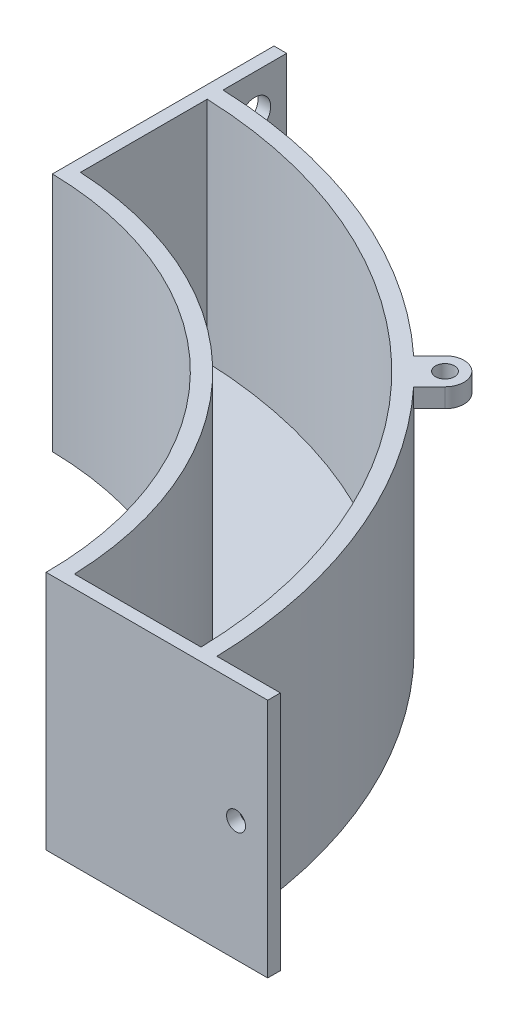
from build123d import *

# Parameters (mm, degrees)
EXTRUDE_1_DEPTH      = 36
EXTRUDE_START        = -2
EXTRUDE_2_DEPTH      = 2
SKETCH_3_R           = 2.5
SKETCH_3_R_2         = 1.5
CUT_EXTRUDE_1_DEPTH  = 126.677663072
EXTRUDE_3_DEPTH      = 2
EXTRUDE_3_DEPTH_BACK = 2
SKETCH_4_R           = 1.5
SKETCH_5_W           = 98.68516208
SKETCH_5_H           = 49.60110529
CUT_EXTRUDE_2_DEPTH  = 133.268193437
EXTRUDE_START_2      = -3
SKETCH_6_R           = 1.5
EXTRUDE_4_DEPTH      = 3


with BuildPart() as part:
    # 草图1 → 凸台-拉伸1 (new body)
    with BuildSketch(Plane(origin=(0, 0, 0), x_dir=(1, 0, 0), z_dir=(0, 1, 0))):
        with BuildLine():
            Line((3, -79.943730211), (3, -89.993749756))
            Line((3, -89.993749756), (1, -89.993749756))
            Line((1, -89.993749756), (1, -54.990908339))
            ThreePointArc((1, -54.990908339), (55, 0), (1, 54.990908339))
            Line((1, 54.990908339), (1, 79.993749756))
            Line((1, 79.993749756), (1, 89.993749756))
            Line((1, 89.993749756), (3, 89.993749756))
            Line((3, 89.993749756), (3, 79.943730211))
            ThreePointArc((3, 79.943730211), (80, 0), (3, -79.943730211))
        make_face()
        with BuildLine():
            Line((3, 77.441913716), (3, 57.421685799))
            ThreePointArc((3, 57.421685799), (57.5, 0), (3, -57.421685799))
            Line((3, -57.421685799), (3, -77.441913716))
            ThreePointArc((3, -77.441913716), (77.5, 0), (3, 77.441913716))
        make_face(mode=Mode.SUBTRACT)
    extrude(amount=EXTRUDE_1_DEPTH)

    # 草图2 → 凸台-拉伸2 (add)
    with BuildSketch(Plane(origin=(0, 0, 0), x_dir=(1, 0, 0), z_dir=(0, 1, 0)).offset(EXTRUDE_START)):
        with BuildLine():
            Line((1, 89.993749756), (1, 54.990908339))
            ThreePointArc((1, 54.990908339), (55, 0), (1, -54.990908339))
            Line((1, -54.990908339), (1, -89.993749756))
            Line((1, -89.993749756), (3, -89.993749756))
            Line((3, -89.993749756), (3, -79.943730211))
            ThreePointArc((3, -79.943730211), (80, 0), (3, 79.943730211))
            Line((3, 79.943730211), (3, 89.993749756))
            Line((3, 89.993749756), (1, 89.993749756))
        make_face()
    extrude(amount=EXTRUDE_2_DEPTH)

    # 草图3 → 切除-拉伸1 (cut, through all)
    with BuildSketch(Plane(origin=(0, 0, 0), x_dir=(0, 0, -1), z_dir=(1, 0, 0))):
        with Locations((-84.968739983, 30)):
            Circle(SKETCH_3_R)
        with Locations((-84.968739983, 17)):
            Circle(SKETCH_3_R_2)
        with Locations((84.968739983, 17)):
            Circle(SKETCH_3_R_2)
        with Locations((84.968739983, 30)):
            Circle(SKETCH_3_R)
        with Locations((-84.968739983, 4)):
            Circle(SKETCH_3_R)
        with Locations((84.968739983, 4)):
            Circle(SKETCH_3_R)
    extrude(amount=CUT_EXTRUDE_1_DEPTH, mode=Mode.SUBTRACT)

    # 草图4 → 凸台-拉伸3 (add, two sides: drawn at the far end of the back side and taken through both)
    with BuildSketch(Plane.XY.offset(-EXTRUDE_3_DEPTH_BACK)):
        Polygon((80, 36), (55, 36), (55, -2), (80, -2), (90, -2), (90, 36), align=None)
        with Locations((85, 17)):
            Circle(SKETCH_4_R, mode=Mode.SUBTRACT)
    extrude(amount=EXTRUDE_3_DEPTH + EXTRUDE_3_DEPTH_BACK)

    # 草图5 → 切除-拉伸2 (cut, through all)
    with BuildSketch(Plane.XY):
        with Locations((47.157910723, 21.418830203)):
            Rectangle(SKETCH_5_W, SKETCH_5_H)
    extrude(amount=CUT_EXTRUDE_2_DEPTH, mode=Mode.SUBTRACT)

    # 草图6 → 凸台-拉伸4 (add)
    with BuildSketch(Plane(origin=(0, 36, 0), x_dir=(1, 0, 0), z_dir=(0, 1, 0)).offset(EXTRUDE_START_2)):
        with BuildLine():
            Line((56.882307136, 61.124947823), (54.407433402, 58.650074089))
            ThreePointArc((54.407433402, 58.650074089), (56.568542495, 56.568542495), (58.650074089, 54.407433402))
            Line((58.650074089, 54.407433402), (61.124947823, 56.882307136))
            ThreePointArc((61.124947823, 56.882307136), (61.124947823, 61.124947823), (56.882307136, 61.124947823))
        make_face()
        with Locations((59.003627479, 59.003627479)):
            Circle(SKETCH_6_R, mode=Mode.SUBTRACT)
    extrude(amount=EXTRUDE_4_DEPTH)


solid = part.part
